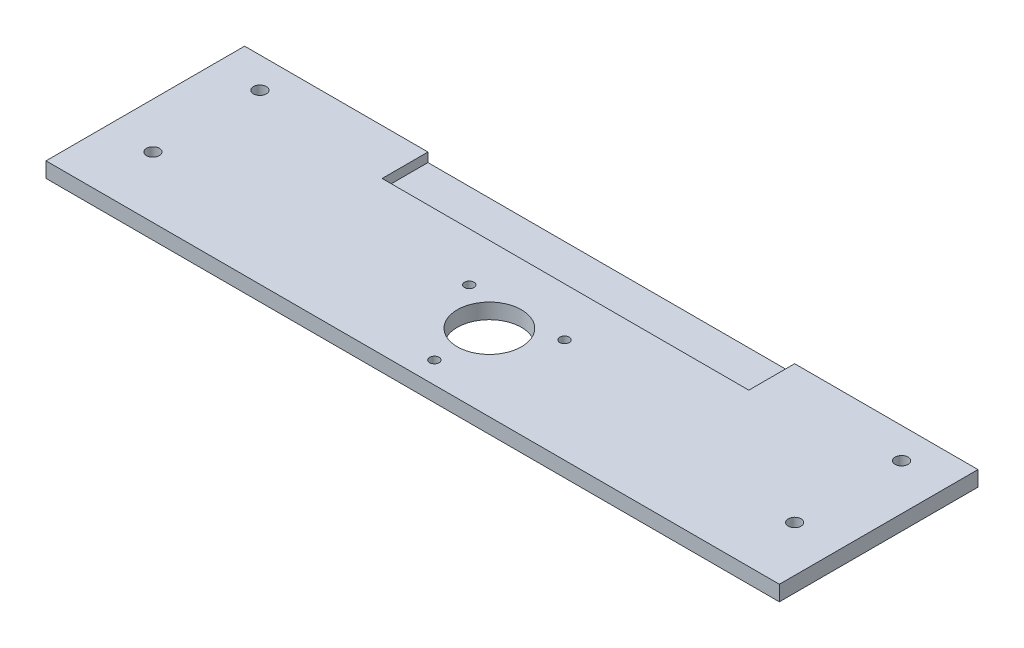
from build123d import *

# Parameters (mm, degrees)
SKETCH_1_W          = 240
SKETCH_1_H          = 65
SKETCH_1_R          = 2.1
EXTRUDE_1_DEPTH     = 5
SKETCH_2_W          = 120
SKETCH_2_H          = 15
CUT_EXTRUDE_1_DEPTH = 3
SKETCH_3_R          = 1.55
CUT_EXTRUDE_2_DEPTH = 32


with BuildPart() as part:
    # 草图1 → 凸台-拉伸1 (new body)
    with BuildSketch(Plane(origin=(0, 0, 0), x_dir=(1, 0, 0), z_dir=(0, 1, 0))):
        with Locations((0, 25)):
            Rectangle(SKETCH_1_W, SKETCH_1_H)
        with Locations(Location((105, 12.5, 0), (0, 0, 270))):
            Circle(SKETCH_1_R, mode=Mode.SUBTRACT)
        with Locations(Location((-105, 12.5, 0), (0, 0, 270))):
            Circle(SKETCH_1_R, mode=Mode.SUBTRACT)
        with Locations(Location((-105, 47.5, 0), (0, 0, 270))):
            Circle(SKETCH_1_R, mode=Mode.SUBTRACT)
        with Locations(Location((105, 47.5, 0), (0, 0, 270))):
            Circle(SKETCH_1_R, mode=Mode.SUBTRACT)
    extrude(amount=EXTRUDE_1_DEPTH)

    # 草图2 → 切除-拉伸1 (cut)
    with BuildSketch(Plane(origin=(0, 5, 0), x_dir=(1, 0, 0), z_dir=(0, 1, 0))):
        with Locations((0, 50)):
            Rectangle(SKETCH_2_W, SKETCH_2_H)
    extrude(amount=-CUT_EXTRUDE_1_DEPTH, mode=Mode.SUBTRACT)

    # 草图3 → 切除-拉伸2 (cut)
    with BuildSketch(Plane(origin=(0, 5, 0), x_dir=(1, 0, 0), z_dir=(0, 1, 0))):
        with BuildLine():
            ThreePointArc((10.5, 17.593406236), (7.424621202, 25.018027438), (0, 28.093406236))
            Line((0, 28.093406236), (0, 7.093406236))
            ThreePointArc((0, 7.093406236), (7.424621202, 10.168785033), (10.5, 17.593406236))
        make_face()
        with BuildLine():
            Line((0, 7.093406236), (0, 28.093406236))
            ThreePointArc((0, 28.093406236), (-10.5, 17.593406236), (0, 7.093406236))
        make_face()
        with Locations(Location((15.588457268, 26.593406236, 0), (0, 0, 270))):
            Circle(SKETCH_3_R)
        with BuildLine():
            ThreePointArc((1.55, -0.406593764), (1.096015511, 0.689421747), (0, 1.143406236))
            Line((0, 1.143406236), (0, -1.956593764))
            ThreePointArc((0, -1.956593764), (1.096015511, -1.502609275), (1.55, -0.406593764))
        make_face()
        with BuildLine():
            Line((0, -1.956593764), (0, 1.143406236))
            ThreePointArc((0, 1.143406236), (-1.55, -0.406593764), (0, -1.956593764))
        make_face()
        with Locations(Location((-15.588457268, 26.593406236, 0), (0, 0, 270))):
            Circle(SKETCH_3_R)
    extrude(amount=-CUT_EXTRUDE_2_DEPTH, mode=Mode.SUBTRACT)


solid = part.part
